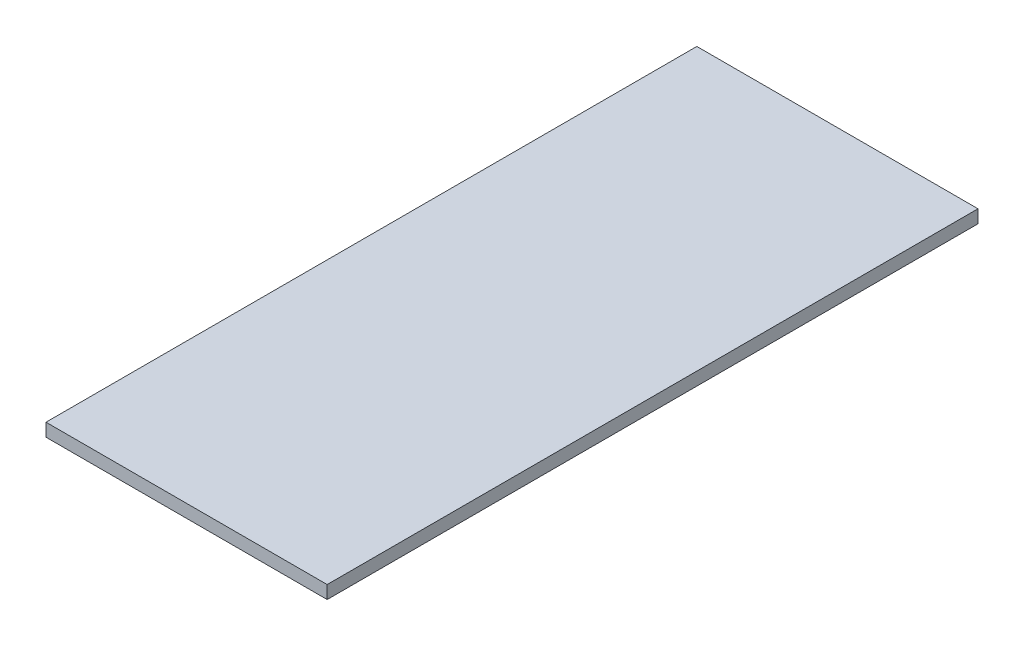
from build123d import *

# Parameters (mm, degrees)
ESBO_O1_W                = 21.6
ESBO_O1_H                = 50
RESSALTO_EXTRUS_O1_DEPTH = 1


with BuildPart() as part:
    # Esboço1 → Ressalto-extrusão1 (new body)
    with BuildSketch(Plane(origin=(0, 0, 0), x_dir=(1, 0, 0), z_dir=(0, 1, 0))):
        Rectangle(ESBO_O1_W, ESBO_O1_H)
    extrude(amount=RESSALTO_EXTRUS_O1_DEPTH)


solid = part.part
